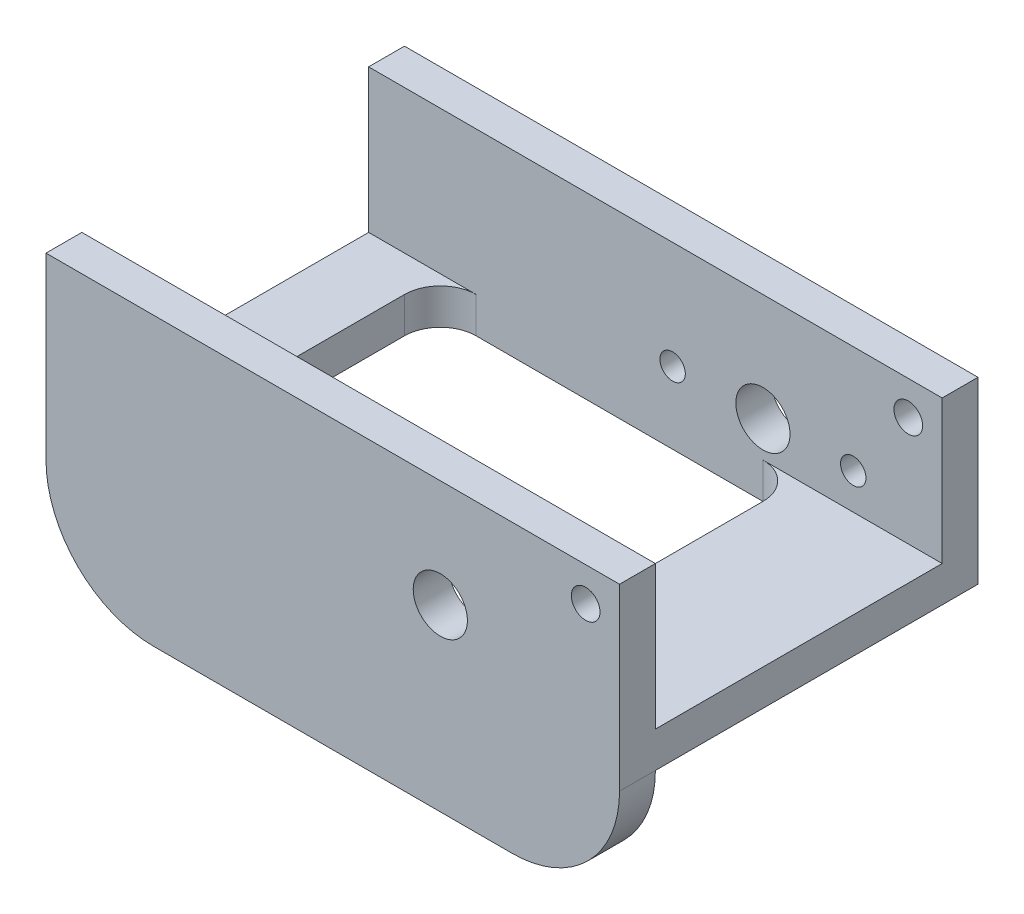
from build123d import *

# Parameters (mm, degrees)
SKETCH1_W           = 101.6
SKETCH1_H           = 63.5
BOSS_EXTRUDE1_DEPTH = 50.8
CUT_EXTRUDE1_REACH  = 132.136
SKETCH2_W           = 50.8
SKETCH2_H           = 25.4
SKETCH2_W_2         = 57.15
SKETCH2_H_2         = 19.05
SKETCH5_W           = 63.5
SKETCH5_H           = 50.8
CUT_EXTRUDE5_DEPTH  = 6.35
CUT_EXTRUDE2_REACH  = 132.136
SKETCH3_R           = 2.25
CUT_EXTRUDE3_REACH  = 132.136
CUT_EXTRUDE4_REACH  = 132.136
SKETCH4_R           = 2.54
FILLET1_R           = 19.05
FILLET2_R           = 6.35


with BuildPart() as part:
    # Sketch1 → Boss-Extrude1 (new body)
    with BuildSketch(Plane(origin=(0, 0, 0), x_dir=(1, 0, 0), z_dir=(0, 1, 0))):
        with Locations((50.8, 31.75)):
            Rectangle(SKETCH1_W, SKETCH1_H)
    extrude(amount=BOSS_EXTRUDE1_DEPTH)

    # Sketch2 → Cut-Extrude1 (cut, up to next)
    with BuildSketch(Plane(origin=(101.6, 0, 0), x_dir=(0, 0, -1), z_dir=(1, 0, 0)), mode=Mode.PRIVATE) as cut_extrude1_sk1:
        with Locations((31.75, 38.1)):
            Rectangle(SKETCH2_W, SKETCH2_H)
    cut_extrude1_tool1 = extrude(cut_extrude1_sk1.sketch, amount=-CUT_EXTRUDE1_REACH, mode=Mode.PRIVATE) & part.part
    # Sketch2 → Cut-Extrude1 (cut, up to next)
    with BuildSketch(Plane(origin=(101.6, 0, 0), x_dir=(0, 0, -1), z_dir=(1, 0, 0)), mode=Mode.PRIVATE) as cut_extrude1_sk2:
        with Locations((34.925, 9.525)):
            Rectangle(SKETCH2_W_2, SKETCH2_H_2)
    cut_extrude1_tool2 = extrude(cut_extrude1_sk2.sketch, amount=-CUT_EXTRUDE1_REACH, mode=Mode.PRIVATE) & part.part
    add(cut_extrude1_tool1.solids().sort_by_distance((101.6, 38.1, -31.75))[0], mode=Mode.SUBTRACT)
    add(cut_extrude1_tool2.solids().sort_by_distance((101.6, 9.525, -34.925))[0], mode=Mode.SUBTRACT)

    # Sketch5 → Cut-Extrude5 (cut)
    with BuildSketch(Plane(origin=(0, 25.4, 0), x_dir=(1, 0, 0), z_dir=(0, 1, 0))):
        with Locations((44.45, 31.75)):
            Rectangle(SKETCH5_W, SKETCH5_H)
    extrude(amount=-CUT_EXTRUDE5_DEPTH, mode=Mode.SUBTRACT)

    # Sketch3 → Cut-Extrude2 (cut, up to next)
    with BuildSketch(Plane(origin=(0, 0, -63.5), x_dir=(-1, 0, 0), z_dir=(0, 0, -1)), mode=Mode.PRIVATE) as cut_extrude2_sk1:
        with Locations((-85.85, 31.75)):
            Circle(SKETCH3_R)
    cut_extrude2_tool1 = extrude(cut_extrude2_sk1.sketch, amount=-CUT_EXTRUDE2_REACH, mode=Mode.PRIVATE) & part.part
    # Sketch3 → Cut-Extrude2 (cut, up to next)
    with BuildSketch(Plane(origin=(0, 0, -63.5), x_dir=(-1, 0, 0), z_dir=(0, 0, -1)), mode=Mode.PRIVATE) as cut_extrude2_sk2:
        with Locations((-53.85, 31.75)):
            Circle(SKETCH3_R)
    cut_extrude2_tool2 = extrude(cut_extrude2_sk2.sketch, amount=-CUT_EXTRUDE2_REACH, mode=Mode.PRIVATE) & part.part
    add(cut_extrude2_tool1.solids().sort_by_distance((85.85, 31.75, -63.5))[0], mode=Mode.SUBTRACT)
    add(cut_extrude2_tool2.solids().sort_by_distance((53.85, 31.75, -63.5))[0], mode=Mode.SUBTRACT)

    # Cut-Extrude3: up to this face of the body (flat: up to its plane)
    cut_extrude3_end = Plane(part.part.faces().sort_by_distance((50.8, 25.4, 0))[0])
    # Sketch3<4> → Cut-Extrude3 (cut, up to the picked face)
    with BuildSketch(Plane(origin=(0, 0, -63.5), x_dir=(-1, 0, 0), z_dir=(0, 0, -1)), mode=Mode.PRIVATE) as cut_extrude3_sk1:
        with BuildLine():
            ThreePointArc((-65.05, 31.75), (-69.85, 36.55), (-74.65, 31.75))
            Line((-74.65, 31.75), (-65.05, 31.75))
        make_face()
    cut_extrude3_tool1 = split(extrude(cut_extrude3_sk1.sketch, amount=-CUT_EXTRUDE3_REACH, mode=Mode.PRIVATE), bisect_by=cut_extrude3_end, keep=Keep.BOTH, mode=Mode.PRIVATE)
    # Sketch3<4> → Cut-Extrude3 (cut, up to the picked face)
    with BuildSketch(Plane(origin=(0, 0, -63.5), x_dir=(-1, 0, 0), z_dir=(0, 0, -1)), mode=Mode.PRIVATE) as cut_extrude3_sk2:
        with BuildLine():
            Line((-65.05, 31.75), (-74.65, 31.75))
            ThreePointArc((-74.65, 31.75), (-69.85, 26.95), (-65.05, 31.75))
        make_face()
    cut_extrude3_tool2 = split(extrude(cut_extrude3_sk2.sketch, amount=-CUT_EXTRUDE3_REACH, mode=Mode.PRIVATE), bisect_by=cut_extrude3_end, keep=Keep.BOTH, mode=Mode.PRIVATE)
    # Sketch3<4> → Cut-Extrude3 (cut, up to the picked face)
    with BuildSketch(Plane(origin=(0, 0, -63.5), x_dir=(-1, 0, 0), z_dir=(0, 0, -1)), mode=Mode.PRIVATE) as cut_extrude3_sk3:
        with BuildLine():
            ThreePointArc((-65.05, 31.75), (-69.85, 36.55), (-74.65, 31.75))
            Line((-74.65, 31.75), (-65.05, 31.75))
        make_face()
    cut_extrude3_tool3 = split(extrude(cut_extrude3_sk3.sketch, amount=-CUT_EXTRUDE3_REACH, mode=Mode.PRIVATE), bisect_by=cut_extrude3_end, keep=Keep.BOTH, mode=Mode.PRIVATE)
    # Sketch3<4> → Cut-Extrude3 (cut, up to the picked face)
    with BuildSketch(Plane(origin=(0, 0, -63.5), x_dir=(-1, 0, 0), z_dir=(0, 0, -1)), mode=Mode.PRIVATE) as cut_extrude3_sk4:
        with BuildLine():
            Line((-65.05, 31.75), (-74.65, 31.75))
            ThreePointArc((-74.65, 31.75), (-69.85, 26.95), (-65.05, 31.75))
        make_face()
    cut_extrude3_tool4 = split(extrude(cut_extrude3_sk4.sketch, amount=-CUT_EXTRUDE3_REACH, mode=Mode.PRIVATE), bisect_by=cut_extrude3_end, keep=Keep.BOTH, mode=Mode.PRIVATE)
    add(cut_extrude3_tool1.solids().sort_by(Axis((69.85, 33.787183, -63.5), (0, 0, 1)))[0], mode=Mode.SUBTRACT)
    add(cut_extrude3_tool2.solids().sort_by(Axis((69.85, 29.712817, -63.5), (0, 0, 1)))[0], mode=Mode.SUBTRACT)
    add(cut_extrude3_tool3.solids().sort_by(Axis((69.85, 33.787183, -63.5), (0, 0, 1)))[0], mode=Mode.SUBTRACT)
    add(cut_extrude3_tool4.solids().sort_by(Axis((69.85, 29.712817, -63.5), (0, 0, 1)))[0], mode=Mode.SUBTRACT)

    # Cut-Extrude4: up to this face of the body (flat: up to its plane)
    cut_extrude4_end = Plane(part.part.faces().sort_by_distance((50.529040984, 25.309680328, 0))[0])
    # Sketch4 → Cut-Extrude4 (cut, up to the picked face)
    with BuildSketch(Plane(origin=(0, 0, -63.5), x_dir=(-1, 0, 0), z_dir=(0, 0, -1)), mode=Mode.PRIVATE) as cut_extrude4_sk1:
        with Locations((-95.6, 44.8)):
            Circle(SKETCH4_R)
    cut_extrude4_tool1 = split(extrude(cut_extrude4_sk1.sketch, amount=-CUT_EXTRUDE4_REACH, mode=Mode.PRIVATE), bisect_by=cut_extrude4_end, keep=Keep.BOTH, mode=Mode.PRIVATE)
    add(cut_extrude4_tool1.solids().sort_by(Axis((95.6, 44.8, -63.5), (0, 0, 1)))[0], mode=Mode.SUBTRACT)

    # Fillet1
    fillet1_edges = [part.edges().sort_by_distance(p)[0] for p in [
        (0, 0, -3.175),
        (101.6, 0, -3.175),
    ]]
    fillet(fillet1_edges, radius=FILLET1_R)

    # Fillet2
    fillet2_edges = [part.edges().sort_by_distance(p)[0] for p in [
        (12.7, 22.225, -6.35),
        (12.7, 22.225, -57.15),
        (76.2, 22.225, -57.15),
        (76.2, 22.225, -6.35),
    ]]
    fillet(fillet2_edges, radius=FILLET2_R)


solid = part.part
